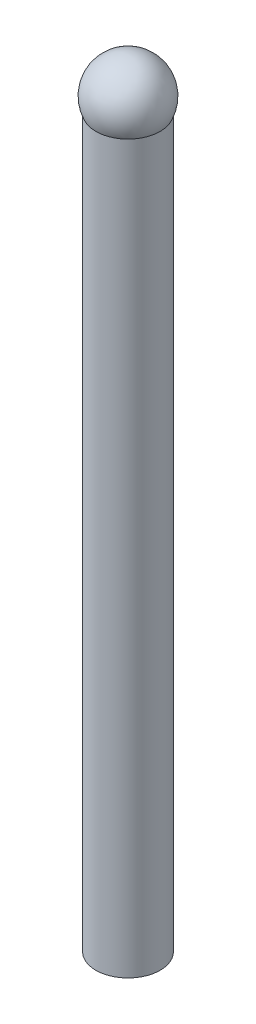
from build123d import *

# Parameters (mm, degrees)
SKETCH_1_R      = 0.65
EXTRUDE_1_DEPTH = 15


with BuildPart() as part:
    # Эскиз1 → Бобышка-Вытянуть1 (new body)
    with BuildSketch(Plane(origin=(0, 0, 0), x_dir=(1, 0, 0), z_dir=(0, 1, 0))):
        with Locations(Location((0, 0, 0), (0, 0, 270))):
            Circle(SKETCH_1_R)
    extrude(amount=EXTRUDE_1_DEPTH)

    # Эскиз3 → Повернуть23 (revolve)
    with BuildSketch(Plane.XY):
        with BuildLine():
            ThreePointArc((-0.715433282, 15.000896847), (0, 14.285463565), (0.715433282, 15.000896847))
            Line((0.715433282, 15.000896847), (-0.715433282, 15.000896847))
        make_face()
        with BuildLine():
            Line((-0.715433282, 15.000896847), (0.715433282, 15.000896847))
            ThreePointArc((0.715433282, 15.000896847), (0, 15.71633013), (-0.715433282, 15.000896847))
        make_face()
    revolve(axis=Axis((0.715433282, 15.000896847, 0), (-1, 0, 0)))


solid = part.part
